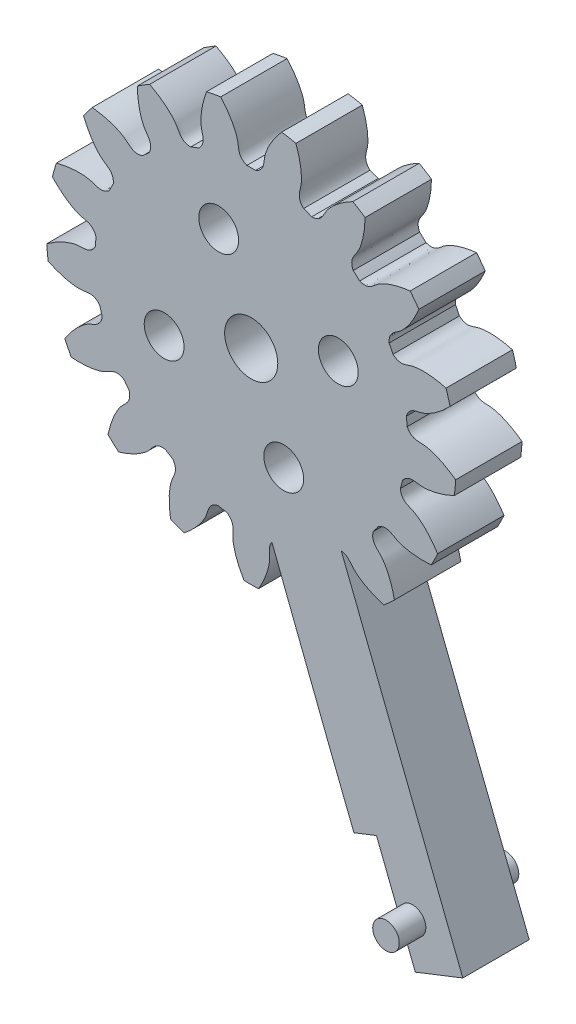
from build123d import *

# Parameters (mm, degrees)
SKETCH_1_R               = 15.4185
EXTRUDE_1_DEPTH          = 5
CUT_EXTRUDE_1_DEPTH      = 23.370969682
PATTERN_CIRCULAR_1_COUNT = 17
SKETCH_4_R               = 2
CUT_EXTRUDE_2_DEPTH      = 10
EXTRUDE_2_DEPTH          = 5
EXTRUDE_3_DEPTH          = 2
EXTRUDE_3_DEPTH_BACK     = 7
SKETCH_15_R              = 1
SKETCH_16_W              = 5
SKETCH_16_H              = 2.485694182
CUT_EXTRUDE_3_DEPTH      = 10
SKETCH_17_R              = 1.5
CUT_EXTRUDE_4_DEPTH      = 10
CUT_EXTRUDE_5_DEPTH      = 10


with BuildPart() as part:
    # 草图1 → 凸台-拉伸1 (new body)
    with BuildSketch(Plane.XY):
        Circle(SKETCH_1_R)
    extrude(amount=EXTRUDE_1_DEPTH)

    # 草图2 → 切除-拉伸1 (cut, through all)
    with BuildSketch(Plane.XY):
        with BuildLine():
            ThreePointArc((0.327348952, 11.762195723), (0, 11.76675), (-0.327348952, 11.762195723))
            add(Edge.make_bspline(
                [(-0.327348952, 11.762195723), (-1.019048819, 12.05048614), (-0.918935099, 12.586062159), (-1.035969996, 13.089209576), (-1.046795617, 13.131937416), (-1.05984903, 13.179440546), (-1.075319607, 13.231645995), (-1.093401755, 13.288473767), (-1.114285386, 13.349838413), (-1.138158687, 13.415648618), (-1.165207064, 13.485807407), (-1.195613266, 13.560212171), (-1.229557151, 13.63875475), (-1.26721556, 13.721321501), (-1.308762166, 13.807793383), (-1.354367329, 13.898046034), (-1.404197952, 13.991949858), (-1.458417341, 14.089370118), (-1.517185067, 14.19016702), (-1.58065683, 14.294195818), (-1.648984323, 14.401306911), (-1.722315103, 14.511345943), (-1.800792459, 14.624153912), (-1.884555287, 14.739567282), (-1.97373797, 14.857418089), (-2.068470251, 14.977534064), (-2.168877117, 15.099738747), (-2.275078688, 15.223851613), (-2.387190097, 15.349688191), (-2.505321389, 15.477060201), (-2.62957741, 15.605775673), (-2.760057705, 15.73563909), (-2.896856419, 15.866451519), (-3.040062202, 15.998010749), (-3.189758115, 16.130111435), (-3.346021539, 16.262545238), (-3.508924092, 16.395100973), (-3.678531546, 16.527564754), (-3.854903748, 16.659720146), (-4.038094542, 16.791348319), (-4.22815171, 16.922228195), (-4.425116859, 17.052136614), (-4.699918513, 17.225597756), (-4.912134312, 17.350723651), (-5.056693187, 17.432187129)],
                knots=[0, 0, 0, 0, 0.193882922, 0.199023975, 0.204850501, 0.211362501, 0.218559975, 0.226442923, 0.235011345, 0.24426524, 0.254204608, 0.264829451, 0.276139767, 0.288135557, 0.300816821, 0.314183558, 0.328235769, 0.342973453, 0.358396612, 0.374505244, 0.39129935, 0.408778929, 0.426943982, 0.445794509, 0.46533051, 0.485551984, 0.506458932, 0.528051354, 0.550329249, 0.573292619, 0.596941461, 0.621275778, 0.646295568, 0.672000832, 0.69839157, 0.725467781, 0.753229466, 0.781676625, 0.810809257, 0.840627364, 0.871130943, 0.902319997, 0.934194524, 1, 1, 1, 1], degree=3))
            ThreePointArc((-5.056693187, 17.432187129), (0, 18.150793208), (5.056693187, 17.432187129))
            add(Edge.make_bspline(
                [(0.327348952, 11.762195723), (1.019048819, 12.05048614), (0.918935099, 12.586062159), (1.035969996, 13.089209576), (1.046795617, 13.131937416), (1.05984903, 13.179440546), (1.075319607, 13.231645995), (1.093401755, 13.288473767), (1.114285386, 13.349838413), (1.138158687, 13.415648618), (1.165207064, 13.485807407), (1.195613266, 13.560212171), (1.229557151, 13.63875475), (1.26721556, 13.721321501), (1.308762166, 13.807793383), (1.354367329, 13.898046034), (1.404197952, 13.991949858), (1.458417341, 14.089370118), (1.517185067, 14.19016702), (1.58065683, 14.294195818), (1.648984323, 14.401306911), (1.722315103, 14.511345943), (1.800792459, 14.624153912), (1.884555287, 14.739567282), (1.97373797, 14.857418089), (2.068470251, 14.977534064), (2.168877117, 15.099738747), (2.275078688, 15.223851613), (2.387190097, 15.349688191), (2.505321389, 15.477060201), (2.62957741, 15.605775673), (2.760057705, 15.73563909), (2.896856419, 15.866451519), (3.040062202, 15.998010749), (3.189758115, 16.130111435), (3.346021539, 16.262545238), (3.508924092, 16.395100973), (3.678531546, 16.527564754), (3.854903748, 16.659720146), (4.038094542, 16.791348319), (4.22815171, 16.922228195), (4.425116859, 17.052136614), (4.699918513, 17.225597756), (4.912134312, 17.350723651), (5.056693187, 17.432187129)],
                knots=[0, 0, 0, 0, 0.193882922, 0.199023975, 0.204850501, 0.211362501, 0.218559975, 0.226442923, 0.235011345, 0.24426524, 0.254204608, 0.264829451, 0.276139767, 0.288135557, 0.300816821, 0.314183558, 0.328235769, 0.342973453, 0.358396612, 0.374505244, 0.39129935, 0.408778929, 0.426943982, 0.445794509, 0.46533051, 0.485551984, 0.506458932, 0.528051354, 0.550329249, 0.573292619, 0.596941461, 0.621275778, 0.646295568, 0.672000832, 0.69839157, 0.725467781, 0.753229466, 0.781676625, 0.810809257, 0.840627364, 0.871130943, 0.902319997, 0.934194524, 1, 1, 1, 1], degree=3))
        make_face()
    cut_extrude_1 = extrude(amount=CUT_EXTRUDE_1_DEPTH, mode=Mode.SUBTRACT)

    # 阵列(圆周)1: 切除-拉伸1 ×17 about axis
    pattern_circular_1_axis = Axis((0, 0, 5), (0, 0, -1))
    for i in range(1, PATTERN_CIRCULAR_1_COUNT):
        add(cut_extrude_1.rotate(pattern_circular_1_axis, i * 360 / PATTERN_CIRCULAR_1_COUNT), mode=Mode.SUBTRACT)

    # 草图4 → 切除-拉伸2 (cut)
    with BuildSketch(Plane.XY.offset(5)):
        Circle(SKETCH_4_R)
    extrude(amount=-CUT_EXTRUDE_2_DEPTH, mode=Mode.SUBTRACT)

    # 草图11 → 凸台-拉伸2 (add)
    with BuildSketch(Plane(origin=(0, 0, 0), x_dir=(-1, 0, 0), z_dir=(0, 0, -1))):
        Polygon((-10.928530931, -20.367001788), (-5.649519948, -6.938188586), (-0.499181806, -8.933440212), (-0.432524695, -8.959263314), (-5.644878568, -22.413899618), (-11.56966666, -37.485448586), (-16.843048827, -35.412425306), align=None)
    extrude(amount=-EXTRUDE_2_DEPTH)

    # 草图15 → 凸台-拉伸3 (add, two sides: drawn at the far end of the back side and taken through both)
    with BuildSketch(Plane(origin=(0, 0, 0), x_dir=(-1, 0, 0), z_dir=(0, 0, -1)).offset(-EXTRUDE_3_DEPTH_BACK)):
        with Locations((-12.148727651, -31.214712157)):
            Circle(SKETCH_15_R)
    extrude(amount=EXTRUDE_3_DEPTH + EXTRUDE_3_DEPTH_BACK)

    # 草图16 → 切除-拉伸3 (cut)
    with BuildSketch(Plane(origin=(-2.742457909, -1.078089717, 0), x_dir=(0, 0, 1), z_dir=(-0.9306711406576417, -0.3658568407820252, 0))):
        with Locations((2.5, -37.876619795)):
            Rectangle(SKETCH_16_W, SKETCH_16_H)
    extrude(amount=-CUT_EXTRUDE_3_DEPTH, mode=Mode.SUBTRACT)

    # 草图17 → 切除-拉伸4 (cut)
    with BuildSketch(Plane(origin=(0, 0, 0), x_dir=(-1, 0, 0), z_dir=(0, 0, -1))):
        with Locations((2.448686553, 6.557738495)):
            Circle(SKETCH_17_R)
        with Locations((6.557738495, -2.448686553)):
            Circle(SKETCH_17_R)
        with Locations((-2.448686553, -6.557738495)):
            Circle(SKETCH_17_R)
        with Locations((-6.557738495, 2.448686553)):
            Circle(SKETCH_17_R)
    extrude(amount=-CUT_EXTRUDE_4_DEPTH, mode=Mode.SUBTRACT)

    # 草图18 → 切除-拉伸5 (cut)
    with BuildSketch(Plane(origin=(0, 0, 0), x_dir=(-1, 0, 0), z_dir=(0, 0, -1))):
        Polygon((-7.733403713, -27.726715621), (-9.430012382, -27.059760495), (-12.356867108, -34.50512962), (-10.660258439, -35.172084746), align=None)
    extrude(amount=-CUT_EXTRUDE_5_DEPTH, mode=Mode.SUBTRACT)


solid = part.part
